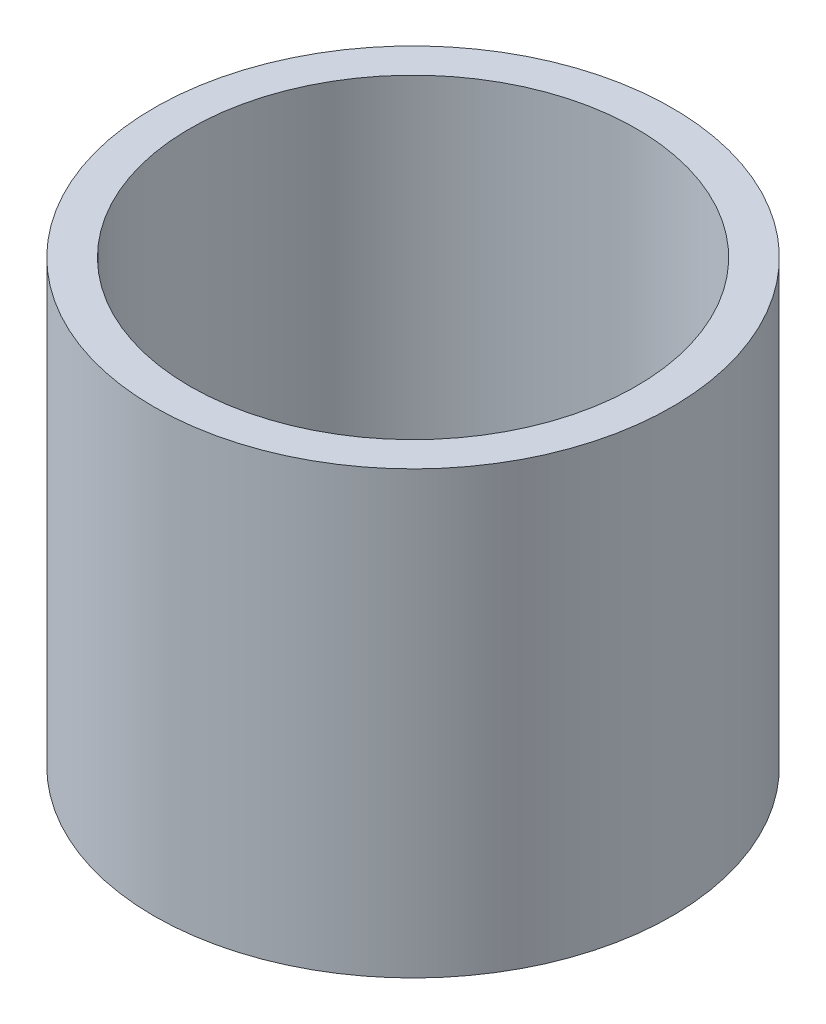
from build123d import *

# Parameters (mm, degrees)
SKETCH1_R           = 4.7
SKETCH1_R_2         = 4.05
BOSS_EXTRUDE1_DEPTH = 8


with BuildPart() as part:
    # Sketch1 → Boss-Extrude1 (new body)
    with BuildSketch(Plane(origin=(0, 0, 0), x_dir=(1, 0, 0), z_dir=(0, 1, 0))):
        with Locations(Location((0, 0, 0), (0, 0, 270))):
            Circle(SKETCH1_R)
        with Locations(Location((0, 0, 0), (0, 0, 270))):
            Circle(SKETCH1_R_2, mode=Mode.SUBTRACT)
    extrude(amount=BOSS_EXTRUDE1_DEPTH)


solid = part.part
